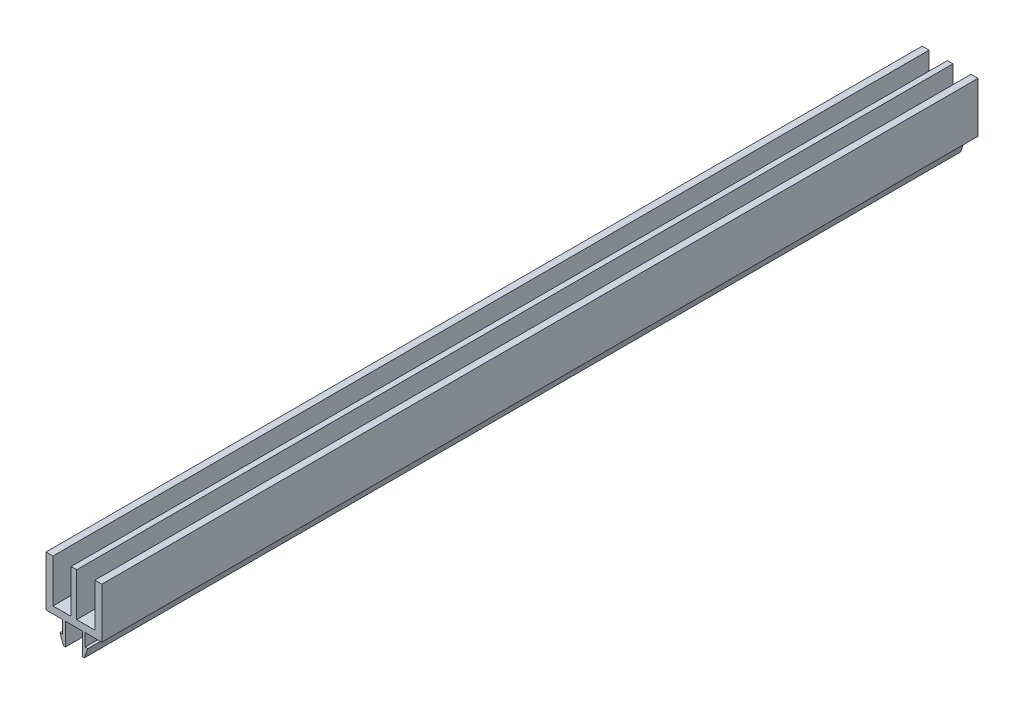
from build123d import *

# Parameters (mm, degrees)
BOSS_EXTRU_1_DEPTH = 314


with BuildPart() as part:
    # Esquisse1 → Boss.-Extru.1 (new body)
    with BuildSketch(Plane.XY.offset(50)):
        Polygon((-1, 2.5), (-7.5, 2.5), (-7.5, 17.999999998), (-10, 17.999999998), (-10, 0), (-4, 0), (-4, -4.5), (-5, -4.5), (-3.75, -8), (-3, -8), (-3, 0), (3, 0), (3, -8), (3.75, -8), (5, -4.5), (4, -4.5), (4, 0), (10, 0), (10, 17.999999998), (7.5, 17.999999998), (7.5, 2.5), (1, 2.5), (1, 17.999999998), (-1, 17.999999998), align=None)
    extrude(amount=-BOSS_EXTRU_1_DEPTH)


solid = part.part
